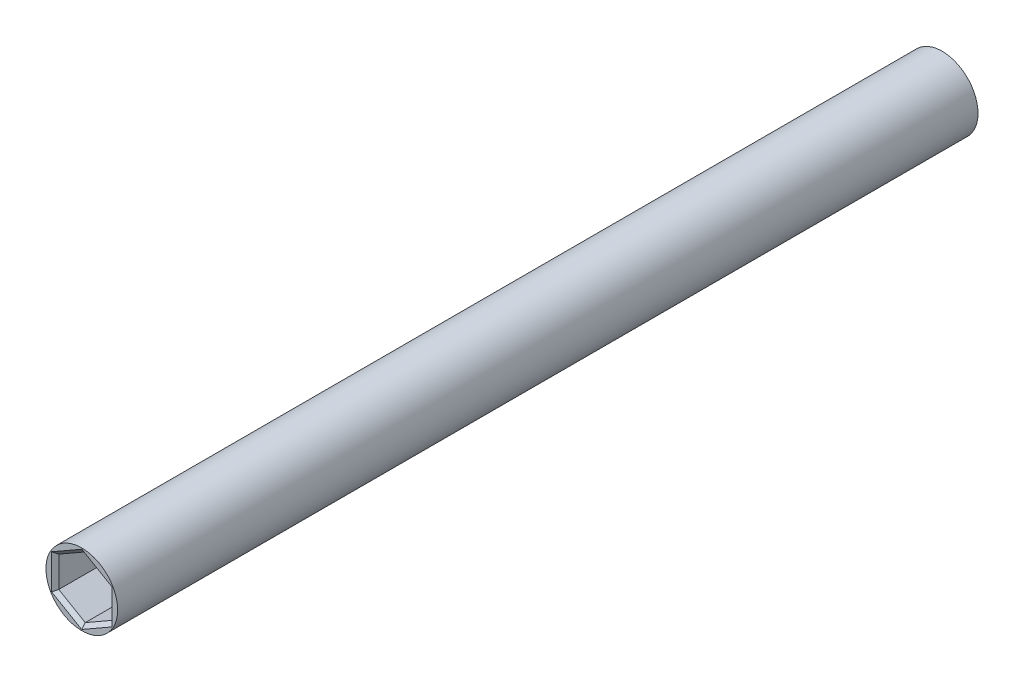
from build123d import *

# Parameters (mm, degrees)
SKETCH1_R           = 0.5
BOSS_EXTRUDE1_DEPTH = 12
CUT_EXTRUDE1_DEPTH  = 1
CHAMFER1_SIZE       = 0.05
SCALE1_SCALE        = 1.9329
SCALE2_SCALE        = 1.5


with BuildPart() as part:
    # Sketch1 → Boss-Extrude1 (new body)
    with BuildSketch(Plane.XY):
        Circle(SKETCH1_R)
    extrude(amount=BOSS_EXTRUDE1_DEPTH)

    # Sketch2 → Cut-Extrude1 (cut)
    with BuildSketch(Plane.XY.offset(12)):
        Polygon((0.369541813, -0.215248582), (0.371181646, 0.212408307), (0.001639833, 0.427656888), (-0.369541813, 0.215248582), (-0.371181646, -0.212408307), (-0.001639833, -0.427656888), align=None)
    extrude(amount=-CUT_EXTRUDE1_DEPTH, mode=Mode.SUBTRACT)

    # Chamfer1
    chamfer1_edges = [part.edges().sort_by_distance(p)[0] for p in [
        (0.18395099, -0.321452735, 12),
        (0.370361729, -0.001420137, 12),
        (0.18641074, 0.320032598, 12),
        (-0.18395099, 0.321452735, 12),
        (-0.370361729, 0.001420137, 12),
        (-0.18641074, -0.320032598, 12),
    ]]
    chamfer(chamfer1_edges, length=CHAMFER1_SIZE)


with BuildPart() as part_1:
    # Scale1: scaled about (0, 0, 5.705631977)
    add(part.part.scale(SCALE1_SCALE).moved(Location((0, 0, -5.322784071))))


with BuildPart() as part_2:
    # Scale2: scaled about (0, 0, 5.705631977)
    add(part_1.part.scale(SCALE2_SCALE).moved(Location((0, 0, -2.852815989))))


solid = part_2.part
